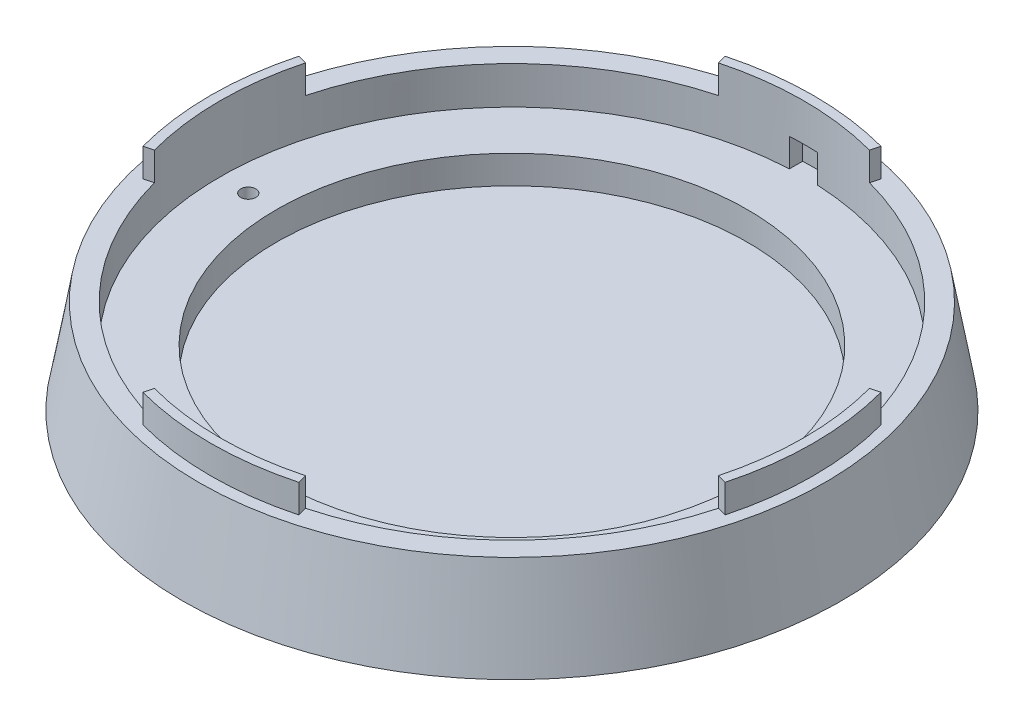
from build123d import *

# Parameters (mm, degrees)
SKETCH_1_R             = 35
EXTRUDE_1_DEPTH        = 6
EXTRUDE_1_TAPER        = 10
SKETCH_4_R             = 25
CUT_EXTRUDE_1_DEPTH    = 3
HOLE_WIZARD_M2_9_D     = 1.6
HOLE_WIZARD_M2_9_DEPTH = 3.519311505
HOLE_WIZARD_M2_9_TIP   = 0.480688495
SKETCH_21_R            = 33.942038116
EXTRUDE_2_DEPTH        = 4
EXTRUDE_2_TAPER        = 10
SKETCH_22_R            = 31
CUT_EXTRUDE_2_DEPTH    = 50.859803602
CUT_EXTRUDE_3_DEPTH    = 3
EXTRUDE_4_DEPTH        = 3


with BuildPart() as part:
    # 草图1 → 凸台-拉伸1 (new body)
    with BuildSketch(Plane(origin=(0, 0, 0), x_dir=(1, 0, 0), z_dir=(0, 1, 0))):
        Circle(SKETCH_1_R)
    extrude(amount=EXTRUDE_1_DEPTH, taper=EXTRUDE_1_TAPER)

    # 草图4 → 切除-拉伸1 (cut)
    with BuildSketch(Plane(origin=(0, 6, 0), x_dir=(1, 0, 0), z_dir=(0, 1, 0))):
        Circle(SKETCH_4_R)
    extrude(amount=-CUT_EXTRUDE_1_DEPTH, mode=Mode.SUBTRACT)

    # M2 螺纹孔9
    with Locations(Plane(origin=(0, 6, 0), x_dir=(1, 0, 0), z_dir=(0, 1, 0))):
        with Locations((-28, 0), (28, 0)):
            Hole(HOLE_WIZARD_M2_9_D / 2, depth=HOLE_WIZARD_M2_9_DEPTH)
            with Locations((0, 0, -(HOLE_WIZARD_M2_9_DEPTH + HOLE_WIZARD_M2_9_TIP / 2))):  # 118° drill point
                Cone(0, HOLE_WIZARD_M2_9_D / 2, HOLE_WIZARD_M2_9_TIP, mode=Mode.SUBTRACT)

    # 草图21 → 凸台-拉伸2 (add)
    with BuildSketch(Plane(origin=(0, 6, 0), x_dir=(1, 0, 0), z_dir=(0, 1, 0))):
        Circle(SKETCH_21_R)
    extrude(amount=EXTRUDE_2_DEPTH, taper=EXTRUDE_2_TAPER)

    # 草图22 → 切除-拉伸2 (cut, through all)
    with BuildSketch(Plane(origin=(0, 6, 0), x_dir=(1, 0, 0), z_dir=(0, 1, 0))):
        Circle(SKETCH_22_R)
    extrude(amount=CUT_EXTRUDE_2_DEPTH, mode=Mode.SUBTRACT)

    # 草图23 → 切除-拉伸3 (cut)
    with BuildSketch(Plane(origin=(0, 6, 0), x_dir=(1, 0, 0), z_dir=(0, 1, 0))):
        with BuildLine():
            Line((-1.5, 32.365259152), (-1.5, 30.542622152))
            Line((-1.5, 30.542622152), (1.5, 30.542622152))
            Line((1.5, 30.542622152), (1.5, 32.365259152))
            ThreePointArc((1.5, 32.365259152), (0, 32.4), (-1.5, 32.365259152))
        make_face()
    extrude(amount=CUT_EXTRUDE_3_DEPTH, mode=Mode.SUBTRACT)

    # 草图31 → 凸台-拉伸4 (add)
    with BuildSketch(Plane(origin=(0, 10, 0), x_dir=(1, 0, 0), z_dir=(0, 1, 0))):
        with BuildLine():
            Line((-8.282209443, 30.909626441), (-8.023390398, 29.943700615))
            ThreePointArc((-8.023390398, 29.943700615), (0, 31), (8.023390398, 29.943700615))
            Line((8.023390398, 29.943700615), (8.282209443, 30.909626441))
            ThreePointArc((8.282209443, 30.909626441), (0, 32), (-8.282209443, 30.909626441))
        make_face()
        with BuildLine():
            Line((30.909626441, -8.282209443), (29.943700615, -8.023390398))
            ThreePointArc((29.943700615, -8.023390398), (31, 0), (29.943700615, 8.023390398))
            Line((29.943700615, 8.023390398), (30.909626441, 8.282209443))
            ThreePointArc((30.909626441, 8.282209443), (32, 0), (30.909626441, -8.282209443))
        make_face()
        with BuildLine():
            Line((-8.282209443, -30.909626441), (-8.023390398, -29.943700615))
            ThreePointArc((-8.023390398, -29.943700615), (0, -31), (8.023390398, -29.943700615))
            Line((8.023390398, -29.943700615), (8.282209443, -30.909626441))
            ThreePointArc((8.282209443, -30.909626441), (0, -32), (-8.282209443, -30.909626441))
        make_face()
        with BuildLine():
            Line((-30.909626441, 8.282209443), (-29.943700615, 8.023390398))
            ThreePointArc((-29.943700615, 8.023390398), (-31, 0), (-29.943700615, -8.023390398))
            Line((-29.943700615, -8.023390398), (-30.909626441, -8.282209443))
            ThreePointArc((-30.909626441, -8.282209443), (-32, 0), (-30.909626441, 8.282209443))
        make_face()
    extrude(amount=EXTRUDE_4_DEPTH)


solid = part.part
